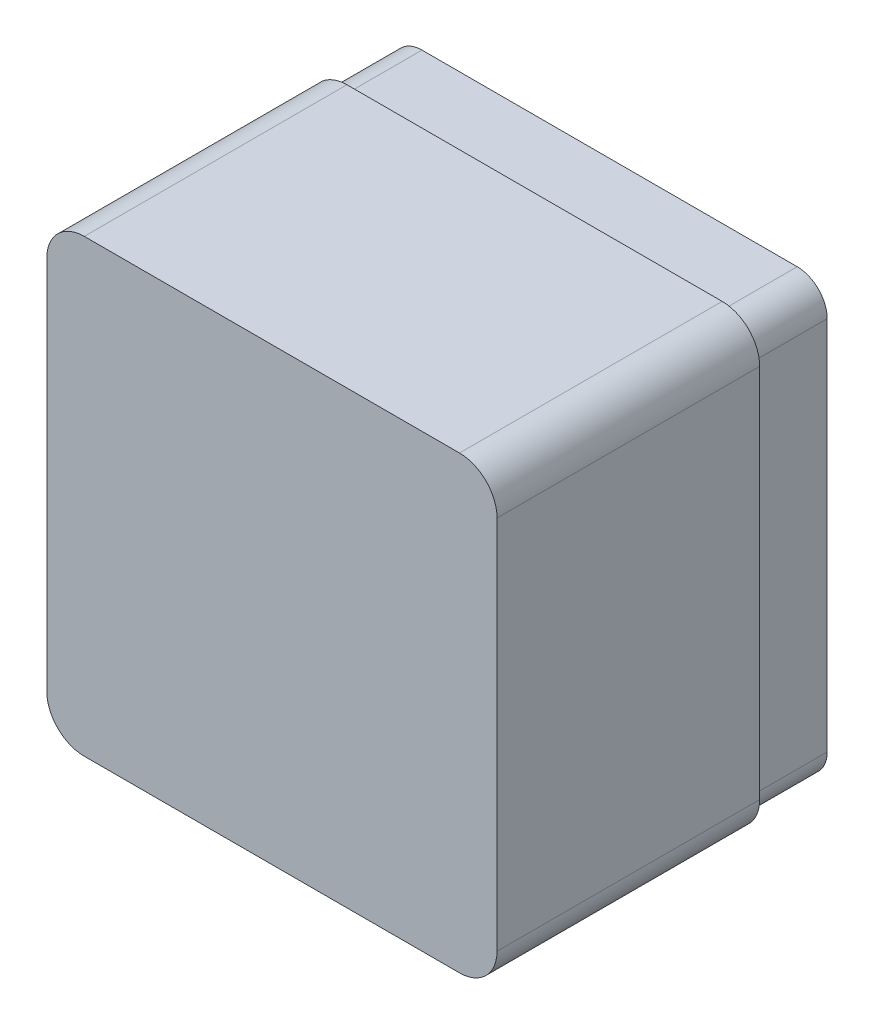
from build123d import *

# Parameters (mm, degrees)
SKETCH1_W           = 120
SKETCH1_H           = 120
BOSS_EXTRUDE1_DEPTH = 90
FILLET1_R           = 10
SHELL1_T            = -4
CUT_EXTRUDE1_START  = -20
CUT_EXTRUDE1_DEPTH  = 20


with BuildPart() as part:
    # Sketch1 → Boss-Extrude1 (new body)
    with BuildSketch(Plane.XY):
        with Locations((60, 60)):
            Rectangle(SKETCH1_W, SKETCH1_H)
    extrude(amount=BOSS_EXTRUDE1_DEPTH)

    # Fillet1
    fillet1_edges = [part.edges().sort_by_distance(p)[0] for p in [
        (0, 120, 45),
        (120, 120, 45),
        (120, 0, 45),
        (0, 0, 45),
    ]]
    fillet(fillet1_edges, radius=FILLET1_R)

    # Shell1
    shell1_openings = [part.faces().sort_by_distance(p)[0] for p in [
        (60, 60, 0),
    ]]
    offset(amount=SHELL1_T, openings=shell1_openings, kind=Kind.INTERSECTION)

    # Sketch2 → Cut-Extrude1 (cut)
    with BuildSketch(Plane(origin=(0, 0, 0), x_dir=(-1, 0, 0), z_dir=(0, 0, -1)).offset(CUT_EXTRUDE1_START)):
        with BuildLine():
            Line((-120, 110), (-120, 10))
            ThreePointArc((-120, 10), (-117.071067812, 2.928932188), (-110, 0))
            Line((-110, 0), (-10, 0))
            ThreePointArc((-10, 0), (-2.928932188, 2.928932188), (0, 10))
            Line((0, 10), (0, 110))
            ThreePointArc((0, 110), (-2.928932188, 117.071067812), (-10, 120))
            Line((-10, 120), (-110, 120))
            ThreePointArc((-110, 120), (-117.071067812, 117.071067812), (-120, 110))
        make_face()
        with BuildLine():
            Line((-118, 110), (-118, 10))
            ThreePointArc((-118, 10), (-115.656854249, 4.343145751), (-110, 2))
            Line((-110, 2), (-10, 2))
            ThreePointArc((-10, 2), (-4.343145751, 4.343145751), (-2, 10))
            Line((-2, 10), (-2, 110))
            ThreePointArc((-2, 110), (-4.343145751, 115.656854249), (-10, 118))
            Line((-10, 118), (-110, 118))
            ThreePointArc((-110, 118), (-115.656854249, 115.656854249), (-118, 110))
        make_face(mode=Mode.SUBTRACT)
    extrude(amount=CUT_EXTRUDE1_DEPTH, mode=Mode.SUBTRACT)


solid = part.part
